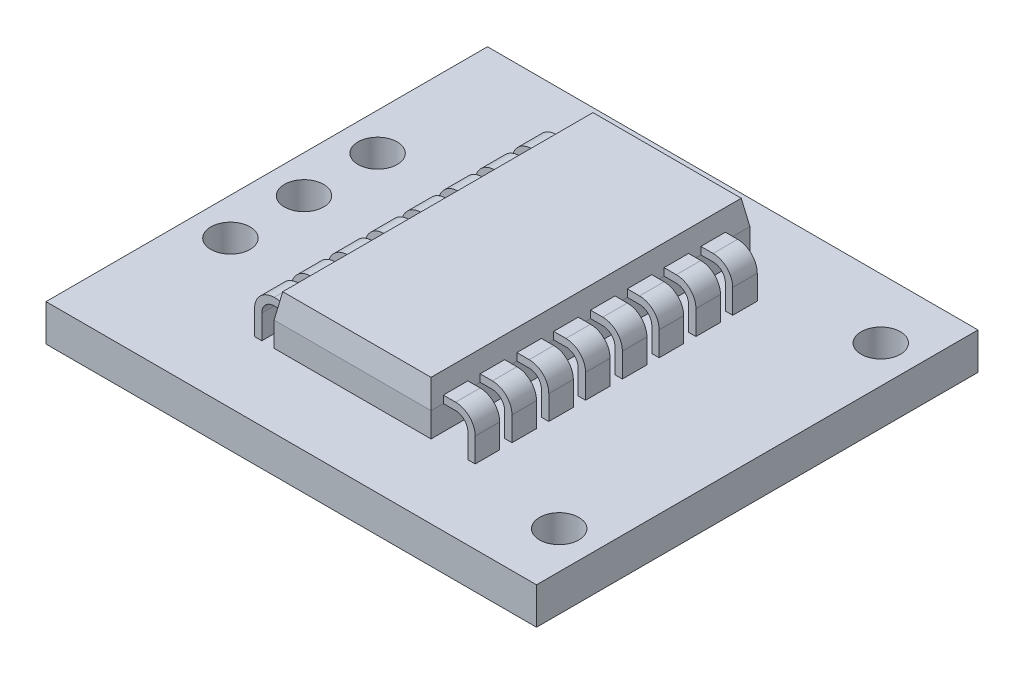
from build123d import *

# Parameters (mm, degrees)
SKETCH1_W                     = 10
SKETCH1_H                     = 9
SKETCH1_R                     = 0.4
BOSS_EXTRUDE1_DEPTH           = 0.75
BOSS_EXTRUDE2_START           = 0.75
SKETCH2_W                     = 3.2
SKETCH2_H                     = 6.5
BOSS_EXTRUDE2_DEPTH           = 0.5
BOSS_EXTRUDE2_TAPER           = 10
BOSS_EXTRUDE2_OTHER_WAY_DEPTH = 0.5
EXTRUDE_THIN1_START           = -0.75
EXTRUDE_THIN1_DEPTH           = 0.5
LPATTERN1_COUNT               = 8
LPATTERN1_PITCH               = 0.75


with BuildPart() as part:
    # Sketch1 → Boss-Extrude1 (new body)
    with BuildSketch(Plane(origin=(0, 0, 0), x_dir=(1, 0, 0), z_dir=(0, 1, 0))):
        Rectangle(SKETCH1_W, SKETCH1_H)
        with Locations(Location((-4.24, 0, 0), (0, 0, 270))):
            Circle(SKETCH1_R, mode=Mode.SUBTRACT)
        with Locations(Location((-4.24, 1.5, 0), (0, 0, 270))):
            Circle(SKETCH1_R, mode=Mode.SUBTRACT)
        with Locations(Location((-4.24, -1.5, 0), (0, 0, 270))):
            Circle(SKETCH1_R, mode=Mode.SUBTRACT)
        with Locations(Location((4.24, 3.277855038, 0), (0, 0, 270))):
            Circle(SKETCH1_R, mode=Mode.SUBTRACT)
        with Locations(Location((4.24, -3.277855038, 0), (0, 0, 270))):
            Circle(SKETCH1_R, mode=Mode.SUBTRACT)
    extrude(amount=BOSS_EXTRUDE1_DEPTH)


with BuildPart() as body_2:
    # Sketch2 → Boss-Extrude2 (new body)
    with BuildSketch(Plane(origin=(0, 0.75, 0), x_dir=(1, 0, 0), z_dir=(0, 1, 0)).offset(BOSS_EXTRUDE2_START)):
        Rectangle(SKETCH2_W, SKETCH2_H)
    extrude(amount=BOSS_EXTRUDE2_DEPTH, taper=BOSS_EXTRUDE2_TAPER)

    # Sketch2 → Boss-Extrude2 other way (add)
    with BuildSketch(Plane(origin=(0, 0.75, 0), x_dir=(1, 0, 0), z_dir=(0, 1, 0)).offset(BOSS_EXTRUDE2_START)):
        Rectangle(SKETCH2_W, SKETCH2_H)
    extrude(amount=-BOSS_EXTRUDE2_OTHER_WAY_DEPTH)


with BuildPart() as body_3:
    # Sketch3 → Extrude-Thin1 (new body)
    with BuildSketch(Plane.XY.offset(3.25).offset(EXTRUDE_THIN1_START)):
        with BuildLine():
            Line((-1.6, 1.5), (-1.85, 1.5))
            ThreePointArc((-1.85, 1.5), (-2.026776695, 1.426776695), (-2.1, 1.25))
            Line((-2.1, 1.25), (-2.1, 0.757948324))
            Line((-2.1, 0.757948324), (-2.25, 0.757948324))
            Line((-2.25, 0.757948324), (-2.25, 1.25))
            ThreePointArc((-2.25, 1.25), (-2.132842712, 1.532842712), (-1.85, 1.65))
            Line((-1.85, 1.65), (-1.6, 1.65))
            Line((-1.6, 1.65), (-1.6, 1.5))
        make_face()
    extrude_thin1 = extrude(amount=EXTRUDE_THIN1_DEPTH)


with BuildPart() as lpattern1_1:
    # LPattern1: pattern copy
    add(extrude_thin1.moved(Location(Vector(0, 0, -1) * (1 * LPATTERN1_PITCH))))


with BuildPart() as lpattern1_2:
    # LPattern1: pattern copy
    add(extrude_thin1.moved(Location(Vector(0, 0, -1) * (2 * LPATTERN1_PITCH))))


with BuildPart() as lpattern1_3:
    # LPattern1: pattern copy
    add(extrude_thin1.moved(Location(Vector(0, 0, -1) * (3 * LPATTERN1_PITCH))))


with BuildPart() as lpattern1_4:
    # LPattern1: pattern copy
    add(extrude_thin1.moved(Location(Vector(0, 0, -1) * (4 * LPATTERN1_PITCH))))


with BuildPart() as lpattern1_5:
    # LPattern1: pattern copy
    add(extrude_thin1.moved(Location(Vector(0, 0, -1) * (5 * LPATTERN1_PITCH))))


with BuildPart() as lpattern1_6:
    # LPattern1: pattern copy
    add(extrude_thin1.moved(Location(Vector(0, 0, -1) * (6 * LPATTERN1_PITCH))))


with BuildPart() as lpattern1_7:
    # LPattern1: pattern copy
    add(extrude_thin1.moved(Location(Vector(0, 0, -1) * (7 * LPATTERN1_PITCH))))


with BuildPart() as body_11:
    # Mirror1: mirrored copy
    add(body_3.part.mirror(Plane(origin=(0, 0, 0), x_dir=(0, 0, 1), z_dir=(1, 0, 0))))


with BuildPart() as body_12:
    # Mirror1 2: mirrored copy
    add(lpattern1_1.part.mirror(Plane(origin=(0, 0, 0), x_dir=(0, 0, 1), z_dir=(1, 0, 0))))


with BuildPart() as body_13:
    # Mirror1 3: mirrored copy
    add(lpattern1_2.part.mirror(Plane(origin=(0, 0, 0), x_dir=(0, 0, 1), z_dir=(1, 0, 0))))


with BuildPart() as body_14:
    # Mirror1 4: mirrored copy
    add(lpattern1_3.part.mirror(Plane(origin=(0, 0, 0), x_dir=(0, 0, 1), z_dir=(1, 0, 0))))


with BuildPart() as body_15:
    # Mirror1 5: mirrored copy
    add(lpattern1_4.part.mirror(Plane(origin=(0, 0, 0), x_dir=(0, 0, 1), z_dir=(1, 0, 0))))


with BuildPart() as body_16:
    # Mirror1 6: mirrored copy
    add(lpattern1_5.part.mirror(Plane(origin=(0, 0, 0), x_dir=(0, 0, 1), z_dir=(1, 0, 0))))


with BuildPart() as body_17:
    # Mirror1 7: mirrored copy
    add(lpattern1_6.part.mirror(Plane(origin=(0, 0, 0), x_dir=(0, 0, 1), z_dir=(1, 0, 0))))


with BuildPart() as body_18:
    # Mirror1 8: mirrored copy
    add(lpattern1_7.part.mirror(Plane(origin=(0, 0, 0), x_dir=(0, 0, 1), z_dir=(1, 0, 0))))


solid = Compound([part.part, body_2.part, body_3.part, lpattern1_1.part, lpattern1_2.part, lpattern1_3.part, lpattern1_4.part, lpattern1_5.part, lpattern1_6.part, lpattern1_7.part, body_11.part, body_12.part, body_13.part, body_14.part, body_15.part, body_16.part, body_17.part, body_18.part])
